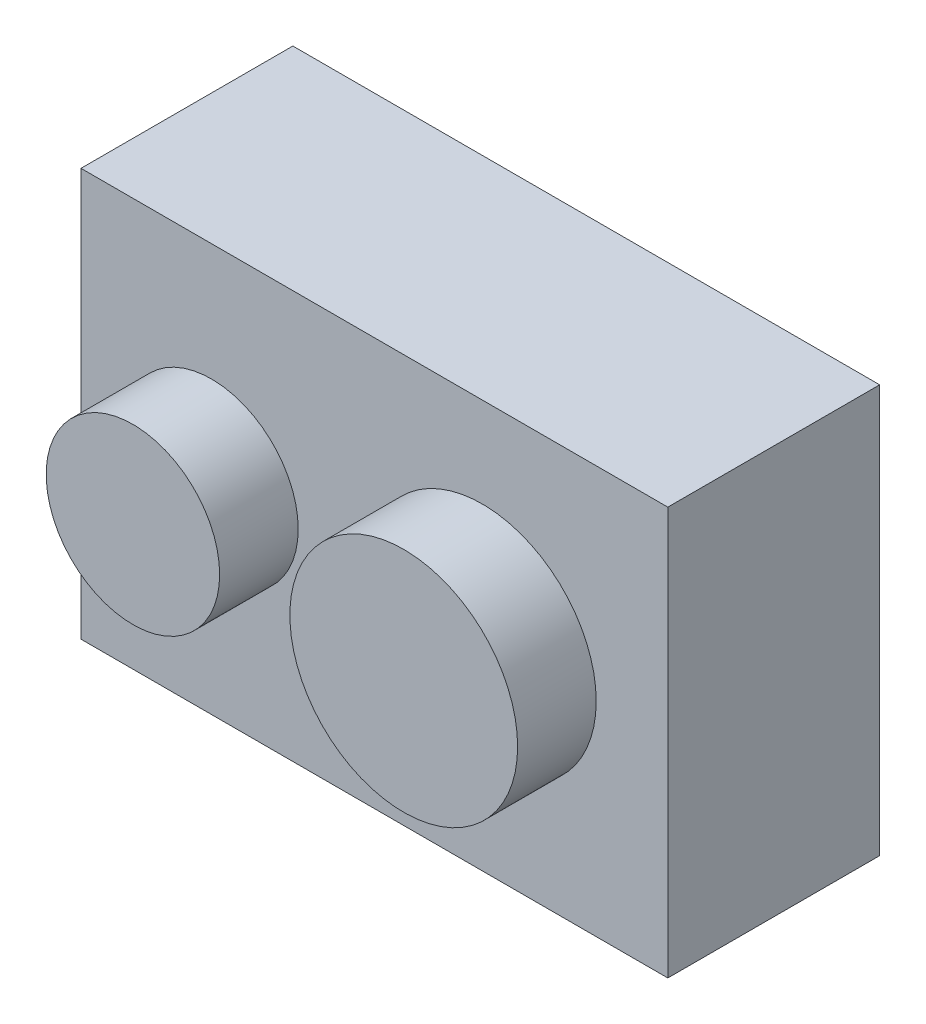
from build123d import *

# Parameters (mm, degrees)
ESBO_O1_W                = 59
ESBO_O1_H                = 41
RESSALTO_EXTRUS_O1_DEPTH = 10.65
ESBO_O2_R                = 11.45
ESBO_O2_R_2              = 8.72
RESSALTO_EXTRUS_O2_DEPTH = 7.9


with BuildPart() as part:
    # Esboço1 → Ressalto-extrusão1 (new, symmetric)
    with BuildSketch(Plane.XY):
        Rectangle(ESBO_O1_W, ESBO_O1_H)
    extrude(amount=RESSALTO_EXTRUS_O1_DEPTH, both=True)

    # Esboço2 → Ressalto-extrusão2 (add)
    with BuildSketch(Plane.XY.offset(10.65)):
        with Locations((10.85, 0)):
            Circle(ESBO_O2_R)
        with Locations((-16.38, 0)):
            Circle(ESBO_O2_R_2)
    extrude(amount=RESSALTO_EXTRUS_O2_DEPTH)


solid = part.part
